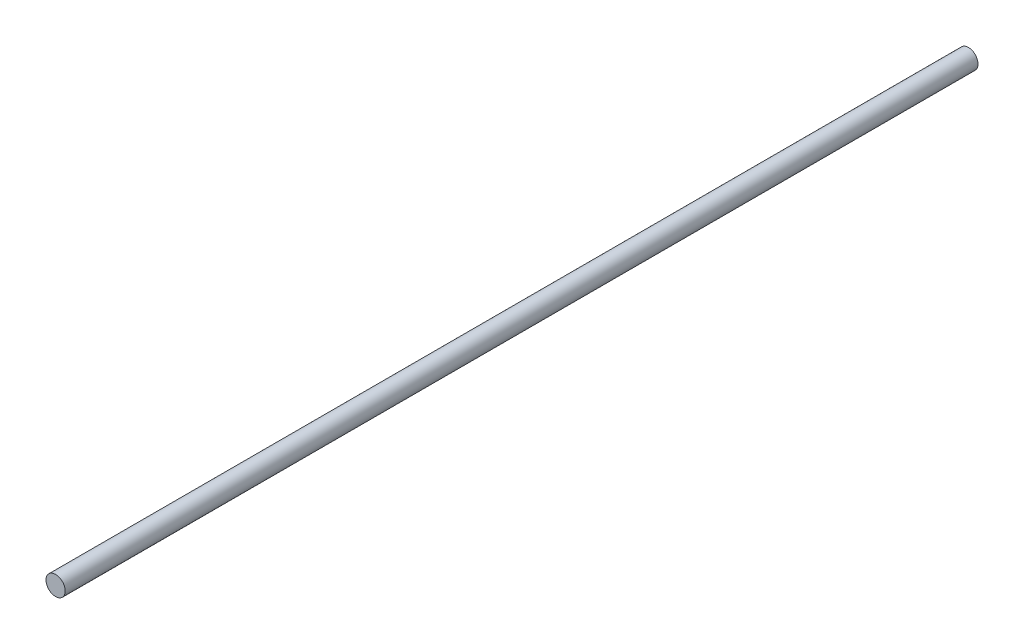
from build123d import *

# Parameters (mm, degrees)
SKETCH1_R           = 5
BOSS_EXTRUDE1_DEPTH = 475


with BuildPart() as part:
    # Sketch1 → Boss-Extrude1 (new body)
    with BuildSketch(Plane.XY):
        with Locations(Location((0, 0, 0), (0, 0, 180))):
            Circle(SKETCH1_R)
    extrude(amount=BOSS_EXTRUDE1_DEPTH)


solid = part.part
